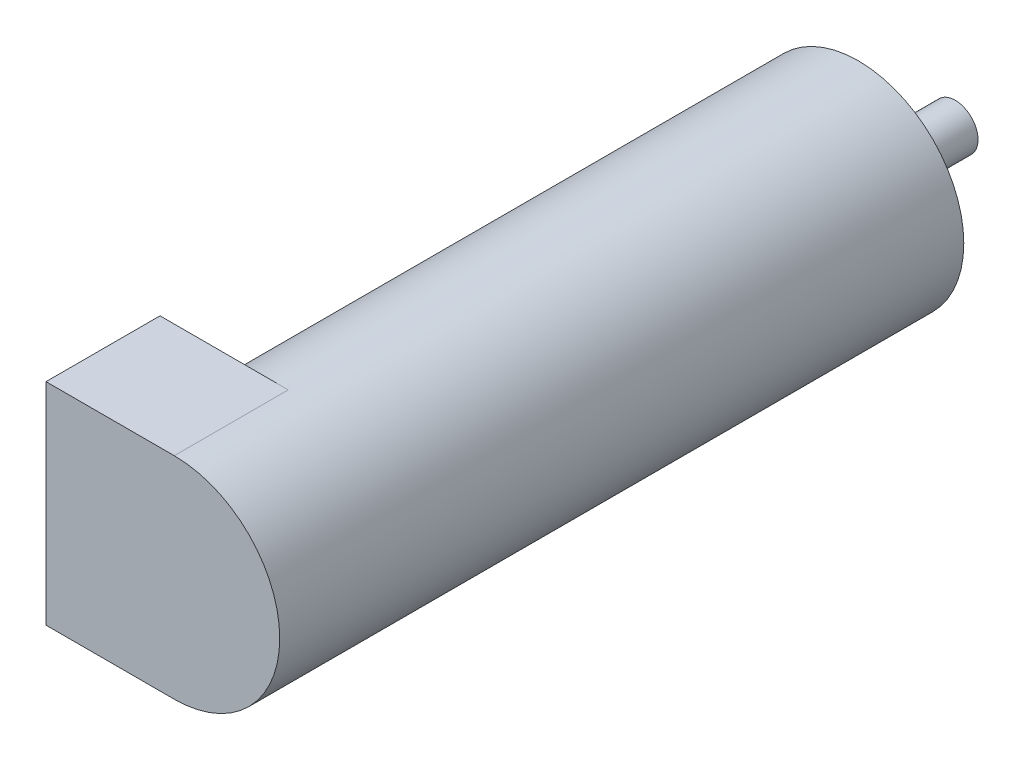
from build123d import *

# Parameters (mm, degrees)
SKETCH_1_R          = 18.5
EXTRUDE_1_DEPTH     = 100
EXTRUDE_2_DEPTH     = 20
SKETCH_3_R          = 4
EXTRUDE_3_DEPTH     = 17
SKETCH_4_R          = 1.5
CUT_EXTRUDE_1_DEPTH = 3


with BuildPart() as part:
    # Эскиз1 → Бобышка-Вытянуть1 (new body)
    with BuildSketch(Plane.XY):
        Circle(SKETCH_1_R)
    extrude(amount=EXTRUDE_1_DEPTH)

    # Эскиз2 → Бобышка-Вытянуть2 (add)
    with BuildSketch(Plane.XY.offset(100)):
        with BuildLine():
            Line((0, 18.5), (-22.5, 18.5))
            Line((-22.5, 18.5), (-22.5, -18.5))
            Line((-22.5, -18.5), (0, -18.5))
            ThreePointArc((0, -18.5), (18.5, 0), (0, 18.5))
        make_face()
    extrude(amount=EXTRUDE_2_DEPTH)

    # Эскиз3 → Бобышка-Вытянуть3 (add)
    with BuildSketch(Plane(origin=(0, 0, 0), x_dir=(-1, 0, 0), z_dir=(0, 0, -1))):
        Circle(SKETCH_3_R)
    extrude(amount=EXTRUDE_3_DEPTH)

    # Эскиз4 → Вырез-Вытянуть1 (cut)
    with BuildSketch(Plane(origin=(0, 0, 0), x_dir=(-1, 0, 0), z_dir=(0, 0, -1))):
        with Locations((15, 0)):
            Circle(SKETCH_4_R)
        with Locations((0, 15)):
            Circle(SKETCH_4_R)
        with Locations((-15, 0)):
            Circle(SKETCH_4_R)
        with Locations((0, -15)):
            Circle(SKETCH_4_R)
    extrude(amount=-CUT_EXTRUDE_1_DEPTH, mode=Mode.SUBTRACT)


solid = part.part
